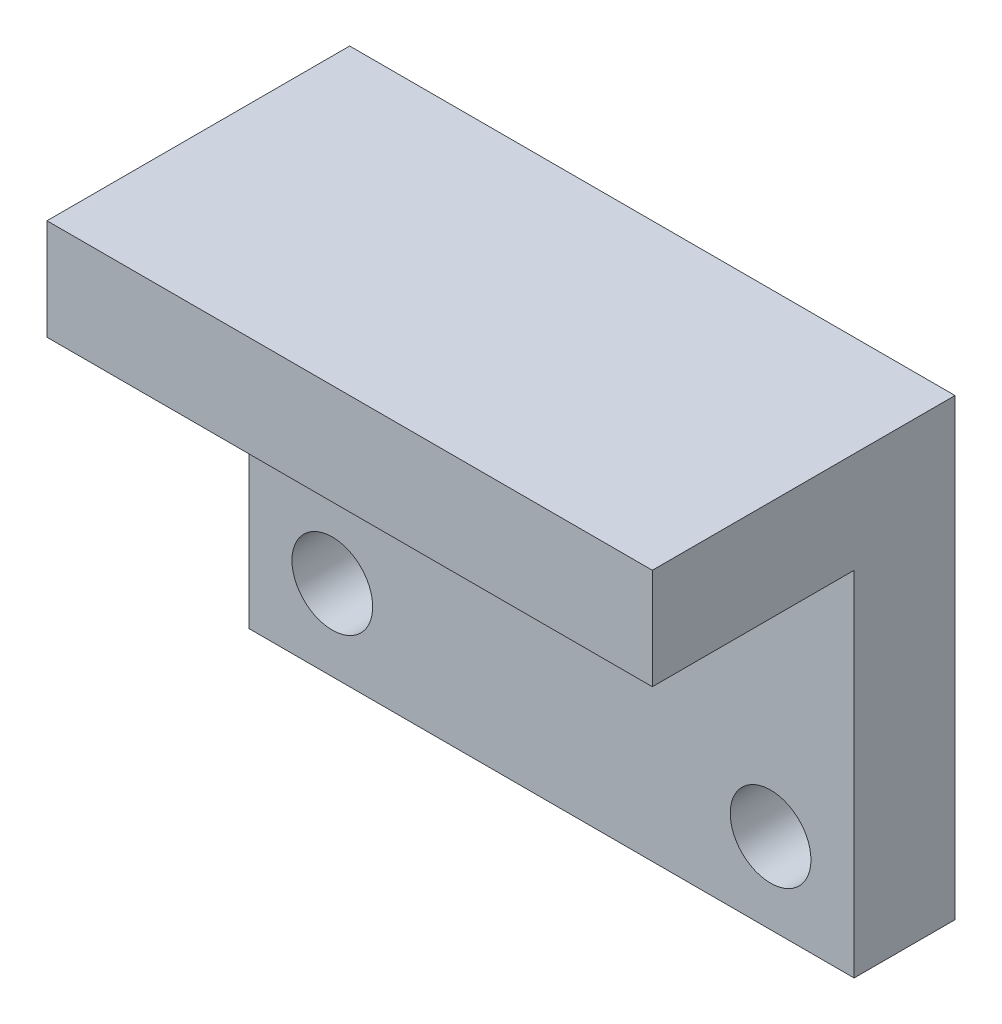
from build123d import *

# Parameters (mm, degrees)
SKETCH4_W           = 30
SKETCH4_H           = 17.5
SKETCH4_R           = 2
BOSS_EXTRUDE2_DEPTH = 5
SKETCH5_W           = 30
SKETCH5_H           = 5
BOSS_EXTRUDE3_DEPTH = 15


with BuildPart() as part:
    # Sketch4 → Boss-Extrude2 (new body)
    with BuildSketch(Plane.XY):
        with Locations((0, 1.25)):
            Rectangle(SKETCH4_W, SKETCH4_H)
        with Locations((10.86, -3.5)):
            Circle(SKETCH4_R, mode=Mode.SUBTRACT)
        with Locations(Location((-10.86, -3.5, 0), (0, 0, 180))):
            Circle(SKETCH4_R, mode=Mode.SUBTRACT)
    extrude(amount=BOSS_EXTRUDE2_DEPTH)

    # Sketch5 → Boss-Extrude3 (add)
    with BuildSketch(Plane.XY):
        with Locations((0, 12.5)):
            Rectangle(SKETCH5_W, SKETCH5_H)
    extrude(amount=BOSS_EXTRUDE3_DEPTH)


solid = part.part
